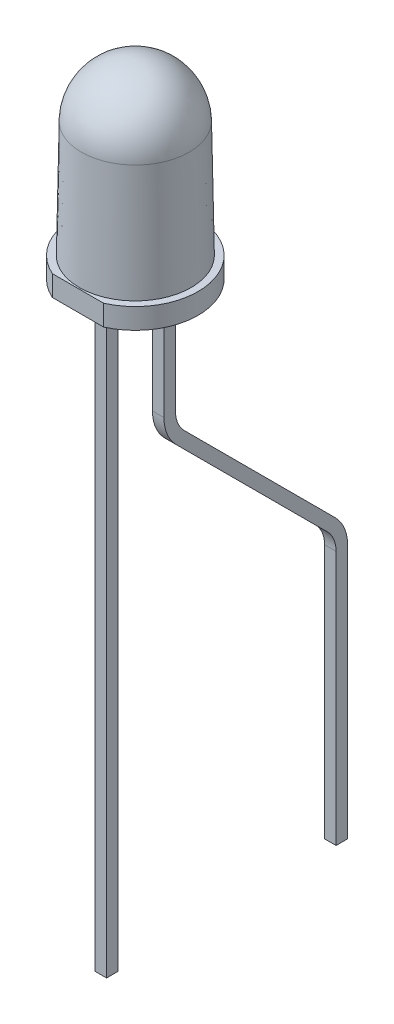
from build123d import *

# Parameters (mm, degrees)
SKETCH2_W      = 8.226207469
SKETCH2_H      = 12.781412334
EXTRUDE1_DEPTH = 11.331323155
SKETCH6_W      = 0.508
SKETCH6_H      = 0.508
EXTRUDE2_DEPTH = 25.908
SKETCH7_W      = 0.508
SKETCH7_H      = 0.508


with BuildPart() as part:
    # Sketch1 → Revolve1 (revolve)
    with BuildSketch(Plane(origin=(0, 0, 0), x_dir=(0, 0, -1), z_dir=(1, 0, 0)), mode=Mode.PRIVATE) as revolve1_sk:
        with BuildLine():
            Line((0, 8.4074), (0, 0))
            Line((0, 0), (2.7813, 0))
            Line((2.7813, 0), (2.7813, 0.9144))
            Line((2.7813, 0.9144), (2.4765, 0.9144))
            Line((2.4765, 0.9144), (2.3876, 6.060688583))
            ThreePointArc((2.3876, 6.060688583), (1.67389428, 7.722503628), (0, 8.4074))
        make_face()
    revolve(revolve1_sk.sketch.rotate(Axis((0, 8.4074, 0), (0, -1, 0)), 180), axis=Axis((0, 8.4074, 0), (0, -1, 0)))

    # Sketch2 → Extrude1 (cut, through all)
    with BuildSketch(Plane.XY.offset(2.54)):
        with Locations((-0.622714808, 4.861343099)):
            Rectangle(SKETCH2_W, SKETCH2_H)
    extrude(amount=EXTRUDE1_DEPTH, mode=Mode.SUBTRACT)

    # Sketch6 → Extrude2 (add)
    with BuildSketch(Plane(origin=(0, 0, 0), x_dir=(1, 0, 0), z_dir=(0, 1, 0))):
        with Locations((0, -1.27)):
            Rectangle(SKETCH6_W, SKETCH6_H)
    extrude(amount=-EXTRUDE2_DEPTH)

    # Sweep1: sweep along a path in Sketch5
    with BuildLine(Plane(origin=(0, 0, 0), x_dir=(0, 0, -1), z_dir=(1, 0, 0))) as sweep1_path:
        Line((1.27, 0), (1.27, -5.69243597))
        ThreePointArc((1.27, -5.69243597), (1.390841242, -6.299945919), (1.734967985, -6.814967985))
        Line((1.734967985, -6.814967985), (8.425032015, -13.505032015))
        ThreePointArc((8.425032015, -13.505032015), (8.769158758, -14.020054081), (8.89, -14.62756403))
        Line((8.89, -14.62756403), (8.89, -25.908))
    # Sketch7 → Sweep1 (sweep)
    with BuildSketch(Plane(origin=(0, 0, 0), x_dir=(1, 0, 0), z_dir=(0, 1, 0))):
        with Locations((0, 1.27)):
            Rectangle(SKETCH7_W, SKETCH7_H)
    sweep(path=sweep1_path.line)


solid = part.part
